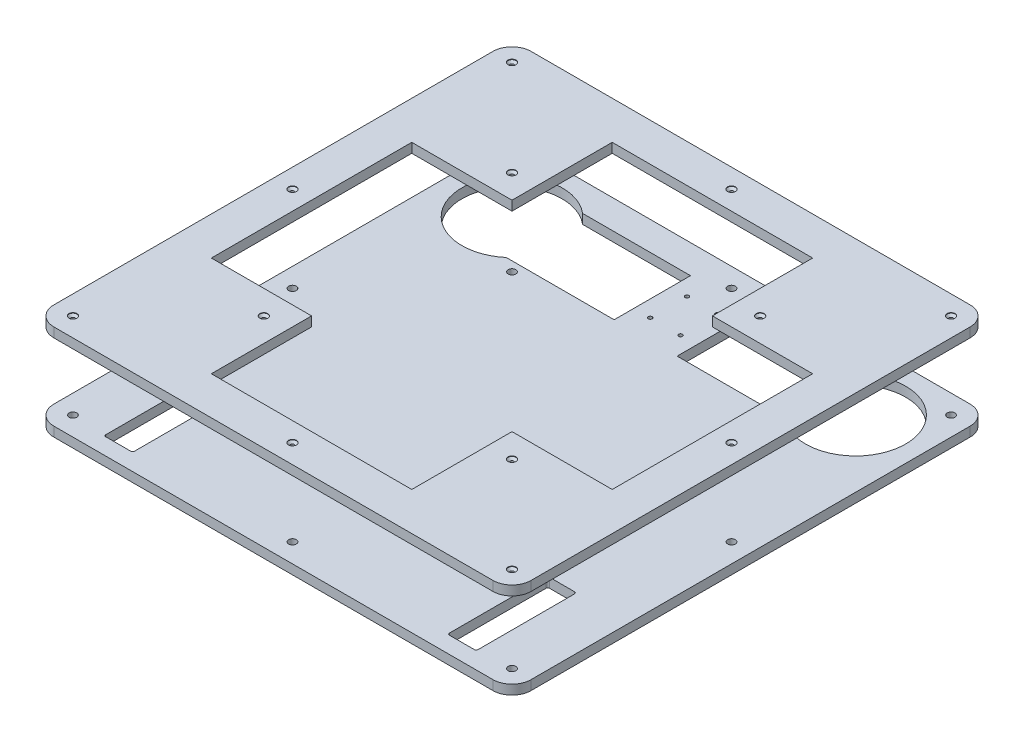
from build123d import *

# Parameters (mm, degrees)
SKETCH1_R                     = 4
SKETCH1_R_2                   = 2
BOSS_EXTRUDE1_DEPTH           = 10
SKETCH3_R                     = 2
BOSS_EXTRUDE2_DEPTH           = 10
SKETCH8_R                     = 4.2
CUT_EXTRUDE3_DEPTH            = 0.5
SKETCH10_R                    = 2
CUT_EXTRUDE4_DEPTH            = 2.2
CUT_EXTRUDE4_DRAFT            = -45
CUT_EXTRUDE4_PROFILE_2_DEPTH  = 2.2
CUT_EXTRUDE4_PROFILE_2_DRAFT  = -45
CUT_EXTRUDE4_PROFILE_3_DEPTH  = 2.2
CUT_EXTRUDE4_PROFILE_3_DRAFT  = -45
CUT_EXTRUDE4_PROFILE_4_DEPTH  = 2.2
CUT_EXTRUDE4_PROFILE_4_DRAFT  = -45
CUT_EXTRUDE4_PROFILE_5_DEPTH  = 2.2
CUT_EXTRUDE4_PROFILE_5_DRAFT  = -45
CUT_EXTRUDE4_PROFILE_6_DEPTH  = 2.2
CUT_EXTRUDE4_PROFILE_6_DRAFT  = -45
CUT_EXTRUDE4_PROFILE_7_DEPTH  = 2.2
CUT_EXTRUDE4_PROFILE_7_DRAFT  = -45
CUT_EXTRUDE4_PROFILE_8_DEPTH  = 2.2
CUT_EXTRUDE4_PROFILE_8_DRAFT  = -45
CUT_EXTRUDE4_PROFILE_9_DEPTH  = 2.2
CUT_EXTRUDE4_PROFILE_9_DRAFT  = -45
CUT_EXTRUDE4_PROFILE_10_DEPTH = 2.2
CUT_EXTRUDE4_PROFILE_10_DRAFT = -45
CUT_EXTRUDE4_PROFILE_11_DEPTH = 2.2
CUT_EXTRUDE4_PROFILE_11_DRAFT = -45
CUT_EXTRUDE4_PROFILE_12_DEPTH = 2.2
CUT_EXTRUDE4_PROFILE_12_DRAFT = -45


with BuildPart() as part:
    # Sketch1 → Boss-Extrude1 (new body)
    with BuildSketch(Plane(origin=(0, 0, 0), x_dir=(1, 0, 0), z_dir=(0, 1, 0))):
        with BuildLine():
            Line((-230, -250), (230, -250))
            ThreePointArc((230, -250), (244.142135624, -244.142135624), (250, -230))
            Line((250, -230), (250, 230))
            ThreePointArc((250, 230), (244.142135624, 244.142135624), (230, 250))
            Line((230, 250), (-230, 250))
            ThreePointArc((-230, 250), (-244.142135624, 244.142135624), (-250, 230))
            Line((-250, 230), (-250, -230))
            ThreePointArc((-250, -230), (-244.142135624, -244.142135624), (-230, -250))
        make_face()
        with Locations(Location((-230, 230, 0), (0, 0, 270))):
            Circle(SKETCH1_R, mode=Mode.SUBTRACT)
        with Locations(Location((230, 230, 0), (0, 0, 270))):
            Circle(SKETCH1_R, mode=Mode.SUBTRACT)
        with Locations(Location((230, -230, 0), (0, 0, 270))):
            Circle(SKETCH1_R, mode=Mode.SUBTRACT)
        with Locations(Location((-230, -230, 0), (0, 0, 270))):
            Circle(SKETCH1_R, mode=Mode.SUBTRACT)
        with Locations(Location((0, 230, 0), (0, 0, 270))):
            Circle(SKETCH1_R, mode=Mode.SUBTRACT)
        with Locations(Location((-230, 0, 0), (0, 0, 270))):
            Circle(SKETCH1_R, mode=Mode.SUBTRACT)
        with Locations(Location((230, 0, 0), (0, 0, 90))):
            Circle(SKETCH1_R, mode=Mode.SUBTRACT)
        with Locations(Location((0, -230, 0), (0, 0, 90))):
            Circle(SKETCH1_R, mode=Mode.SUBTRACT)
        with Locations(Location((-130, 130, 0), (0, 0, 270))):
            Circle(SKETCH1_R, mode=Mode.SUBTRACT)
        with Locations(Location((130, 130, 0), (0, 0, 90))):
            Circle(SKETCH1_R, mode=Mode.SUBTRACT)
        with Locations(Location((-130, -130, 0), (0, 0, 90))):
            Circle(SKETCH1_R, mode=Mode.SUBTRACT)
        with Locations(Location((130, -130, 0), (0, 0, 270))):
            Circle(SKETCH1_R, mode=Mode.SUBTRACT)
        with Locations(Location((15.90957387, 199.284331964, 0), (0, 0, 270))):
            Circle(SKETCH1_R_2, mode=Mode.SUBTRACT)
        with Locations(Location((15.90957387, 160.715668036, 0), (0, 0, 270))):
            Circle(SKETCH1_R_2, mode=Mode.SUBTRACT)
        with Locations(Location((-15.90957387, 160.715668036, 0), (0, 0, 270))):
            Circle(SKETCH1_R_2, mode=Mode.SUBTRACT)
        with Locations(Location((-15.90957387, 199.284331964, 0), (0, 0, 270))):
            Circle(SKETCH1_R_2, mode=Mode.SUBTRACT)
        with BuildLine():
            Line((-193, -232.5), (-167, -232.5))
            ThreePointArc((-167, -232.5), (-165.585786438, -231.914213562), (-165, -230.5))
            Line((-165, -230.5), (-165, -129.5))
            ThreePointArc((-165, -129.5), (-165.585786438, -128.085786438), (-167, -127.5))
            Line((-167, -127.5), (-193, -127.5))
            ThreePointArc((-193, -127.5), (-194.414213562, -128.085786438), (-195, -129.5))
            Line((-195, -129.5), (-195, -230.5))
            ThreePointArc((-195, -230.5), (-194.414213562, -231.914213562), (-193, -232.5))
        make_face(mode=Mode.SUBTRACT)
        with BuildLine():
            Line((193, -232.5), (167, -232.5))
            ThreePointArc((167, -232.5), (165.585786438, -231.914213562), (165, -230.5))
            Line((165, -230.5), (165, -129.5))
            ThreePointArc((165, -129.5), (165.585786438, -128.085786438), (167, -127.5))
            Line((167, -127.5), (193, -127.5))
            ThreePointArc((193, -127.5), (194.414213562, -128.085786438), (195, -129.5))
            Line((195, -129.5), (195, -230.5))
            ThreePointArc((195, -230.5), (194.414213562, -231.914213562), (193, -232.5))
        make_face(mode=Mode.SUBTRACT)
        with BuildLine():
            Line((33, 220), (145.996323728, 220))
            ThreePointArc((145.996323728, 220), (232.5, 180), (145.996323728, 140))
            Line((145.996323728, 140), (33, 140))
            Line((33, 140), (33, 220))
        make_face(mode=Mode.SUBTRACT)
        with BuildLine():
            Line((-33, 220), (-33, 140))
            Line((-33, 140), (-145.996323728, 140))
            ThreePointArc((-145.996323728, 140), (-232.5, 180), (-145.996323728, 220))
            Line((-145.996323728, 220), (-33, 220))
        make_face(mode=Mode.SUBTRACT)
    extrude(amount=-BOSS_EXTRUDE1_DEPTH)


with BuildPart() as body_2:
    # Sketch3 → Boss-Extrude2 (new body)
    with BuildSketch(Plane(origin=(0, 80, 0), x_dir=(1, 0, 0), z_dir=(0, 1, 0))):
        with BuildLine():
            ThreePointArc((-250, -230), (-244.142135624, -244.142135624), (-230, -250))
            Line((-230, -250), (230, -250))
            ThreePointArc((230, -250), (244.142135624, -244.142135624), (250, -230))
            Line((250, -230), (250, 230))
            ThreePointArc((250, 230), (244.142135624, 244.142135624), (230, 250))
            Line((230, 250), (-230, 250))
            ThreePointArc((-230, 250), (-244.142135624, 244.142135624), (-250, 230))
            Line((-250, 230), (-250, -230))
        make_face()
        with Locations(Location((-230, -230, 0), (0, 0, 270))):
            Circle(SKETCH3_R, mode=Mode.SUBTRACT)
        with Locations(Location((-130, -130, 0), (0, 0, 270))):
            Circle(SKETCH3_R, mode=Mode.SUBTRACT)
        with Locations(Location((0, -230, 0), (0, 0, 270))):
            Circle(SKETCH3_R, mode=Mode.SUBTRACT)
        with Locations(Location((-230, 0, 0), (0, 0, 270))):
            Circle(SKETCH3_R, mode=Mode.SUBTRACT)
        with Locations(Location((230, -230, 0), (0, 0, 270))):
            Circle(SKETCH3_R, mode=Mode.SUBTRACT)
        with Locations(Location((130, -130, 0), (0, 0, 270))):
            Circle(SKETCH3_R, mode=Mode.SUBTRACT)
        Polygon((105, -210), (-105, -210), (-105, -105), (-210, -105), (-210, 105), (-105, 105), (-105, 210), (105, 210), (105, 105), (210, 105), (210, -105), (105, -105), align=None, mode=Mode.SUBTRACT)
        with Locations(Location((230, 0, 0), (0, 0, 270))):
            Circle(SKETCH3_R, mode=Mode.SUBTRACT)
        with Locations(Location((-130, 130, 0), (0, 0, 270))):
            Circle(SKETCH3_R, mode=Mode.SUBTRACT)
        with Locations(Location((-230, 230, 0), (0, 0, 270))):
            Circle(SKETCH3_R, mode=Mode.SUBTRACT)
        with Locations(Location((0, 230, 0), (0, 0, 270))):
            Circle(SKETCH3_R, mode=Mode.SUBTRACT)
        with Locations(Location((130, 130, 0), (0, 0, 270))):
            Circle(SKETCH3_R, mode=Mode.SUBTRACT)
        with Locations(Location((230, 230, 0), (0, 0, 270))):
            Circle(SKETCH3_R, mode=Mode.SUBTRACT)
    extrude(amount=BOSS_EXTRUDE2_DEPTH)

    # Sketch8 → Cut-Extrude3 (cut)
    with BuildSketch(Plane(origin=(0, 90, 0), x_dir=(1, 0, 0), z_dir=(0, 1, 0))):
        with Locations(Location((-230, 230, 0), (0, 0, 270))):
            Circle(SKETCH8_R)
        with Locations(Location((0, 230, 0), (0, 0, 270))):
            Circle(SKETCH8_R)
        with Locations(Location((230, 230, 0), (0, 0, 270))):
            Circle(SKETCH8_R)
        with Locations(Location((-130, 130, 0), (0, 0, 270))):
            Circle(SKETCH8_R)
        with Locations(Location((-230, 0, 0), (0, 0, 270))):
            Circle(SKETCH8_R)
        with Locations(Location((-130, -130, 0), (0, 0, 270))):
            Circle(SKETCH8_R)
        with Locations(Location((130, 130, 0), (0, 0, 270))):
            Circle(SKETCH8_R)
        with Locations(Location((230, 0, 0), (0, 0, 270))):
            Circle(SKETCH8_R)
        with Locations(Location((130, -130, 0), (0, 0, 270))):
            Circle(SKETCH8_R)
        with Locations(Location((230, -230, 0), (0, 0, 270))):
            Circle(SKETCH8_R)
        with Locations(Location((0, -230, 0), (0, 0, 270))):
            Circle(SKETCH8_R)
        with Locations(Location((-230, -230, 0), (0, 0, 270))):
            Circle(SKETCH8_R)
    extrude(amount=-CUT_EXTRUDE3_DEPTH, mode=Mode.SUBTRACT)


with BuildPart() as cut_extrude4_tool:
    # Sketch10 → Cut-Extrude4 (with draft: the straight prism first)
    with BuildSketch(Plane(origin=(0, 87.3, 0), x_dir=(1, 0, 0), z_dir=(0, 1, 0))):
        with Locations(Location((-230, -230, 0), (0, 0, 270))):
            Circle(SKETCH10_R)
    extrude(amount=CUT_EXTRUDE4_DEPTH)
    # Cut-Extrude4: the draft: its side faces are tilted about the plane it starts from
    cut_extrude4_sides = [cut_extrude4_tool.faces().sort_by_distance(p)[0] for p in [
        (-230, 88.4, 228),
    ]]
    draft(cut_extrude4_sides, Plane(origin=(0, 87.3, 0), x_dir=(1, 0, 0), z_dir=(0, 1, 0)), CUT_EXTRUDE4_DRAFT)


with BuildPart() as body_2_1:
    add(body_2.part)

    # Cut-Extrude4: cut by cut_extrude4_tool
    add(cut_extrude4_tool.part, mode=Mode.SUBTRACT)


with BuildPart() as cut_extrude4_profile_2_tool:
    # Sketch10 → Cut-Extrude4 profile 2 (with draft: the straight prism first)
    with BuildSketch(Plane(origin=(0, 87.3, 0), x_dir=(1, 0, 0), z_dir=(0, 1, 0))):
        with Locations(Location((-130, -130, 0), (0, 0, 270))):
            Circle(SKETCH10_R)
    extrude(amount=CUT_EXTRUDE4_PROFILE_2_DEPTH)
    # Cut-Extrude4 profile 2: the draft: its side faces are tilted about the plane it starts from
    cut_extrude4_profile_2_sides = [cut_extrude4_profile_2_tool.faces().sort_by_distance(p)[0] for p in [
        (-130, 88.4, 128),
    ]]
    draft(cut_extrude4_profile_2_sides, Plane(origin=(0, 87.3, 0), x_dir=(1, 0, 0), z_dir=(0, 1, 0)), CUT_EXTRUDE4_PROFILE_2_DRAFT)


with BuildPart() as body_2_2:
    add(body_2_1.part)

    # Cut-Extrude4 profile 2: cut by cut_extrude4_profile_2_tool
    add(cut_extrude4_profile_2_tool.part, mode=Mode.SUBTRACT)


with BuildPart() as cut_extrude4_profile_3_tool:
    # Sketch10 → Cut-Extrude4 profile 3 (with draft: the straight prism first)
    with BuildSketch(Plane(origin=(0, 87.3, 0), x_dir=(1, 0, 0), z_dir=(0, 1, 0))):
        with Locations(Location((0, -230, 0), (0, 0, 270))):
            Circle(SKETCH10_R)
    extrude(amount=CUT_EXTRUDE4_PROFILE_3_DEPTH)
    # Cut-Extrude4 profile 3: the draft: its side faces are tilted about the plane it starts from
    cut_extrude4_profile_3_sides = [cut_extrude4_profile_3_tool.faces().sort_by_distance(p)[0] for p in [
        (0, 88.4, 228),
    ]]
    draft(cut_extrude4_profile_3_sides, Plane(origin=(0, 87.3, 0), x_dir=(1, 0, 0), z_dir=(0, 1, 0)), CUT_EXTRUDE4_PROFILE_3_DRAFT)


with BuildPart() as body_2_3:
    add(body_2_2.part)

    # Cut-Extrude4 profile 3: cut by cut_extrude4_profile_3_tool
    add(cut_extrude4_profile_3_tool.part, mode=Mode.SUBTRACT)


with BuildPart() as cut_extrude4_profile_4_tool:
    # Sketch10 → Cut-Extrude4 profile 4 (with draft: the straight prism first)
    with BuildSketch(Plane(origin=(0, 87.3, 0), x_dir=(1, 0, 0), z_dir=(0, 1, 0))):
        with Locations(Location((230, -230, 0), (0, 0, 270))):
            Circle(SKETCH10_R)
    extrude(amount=CUT_EXTRUDE4_PROFILE_4_DEPTH)
    # Cut-Extrude4 profile 4: the draft: its side faces are tilted about the plane it starts from
    cut_extrude4_profile_4_sides = [cut_extrude4_profile_4_tool.faces().sort_by_distance(p)[0] for p in [
        (230, 88.4, 228),
    ]]
    draft(cut_extrude4_profile_4_sides, Plane(origin=(0, 87.3, 0), x_dir=(1, 0, 0), z_dir=(0, 1, 0)), CUT_EXTRUDE4_PROFILE_4_DRAFT)


with BuildPart() as body_2_4:
    add(body_2_3.part)

    # Cut-Extrude4 profile 4: cut by cut_extrude4_profile_4_tool
    add(cut_extrude4_profile_4_tool.part, mode=Mode.SUBTRACT)


with BuildPart() as cut_extrude4_profile_5_tool:
    # Sketch10 → Cut-Extrude4 profile 5 (with draft: the straight prism first)
    with BuildSketch(Plane(origin=(0, 87.3, 0), x_dir=(1, 0, 0), z_dir=(0, 1, 0))):
        with Locations(Location((130, -130, 0), (0, 0, 270))):
            Circle(SKETCH10_R)
    extrude(amount=CUT_EXTRUDE4_PROFILE_5_DEPTH)
    # Cut-Extrude4 profile 5: the draft: its side faces are tilted about the plane it starts from
    cut_extrude4_profile_5_sides = [cut_extrude4_profile_5_tool.faces().sort_by_distance(p)[0] for p in [
        (130, 88.4, 128),
    ]]
    draft(cut_extrude4_profile_5_sides, Plane(origin=(0, 87.3, 0), x_dir=(1, 0, 0), z_dir=(0, 1, 0)), CUT_EXTRUDE4_PROFILE_5_DRAFT)


with BuildPart() as body_2_5:
    add(body_2_4.part)

    # Cut-Extrude4 profile 5: cut by cut_extrude4_profile_5_tool
    add(cut_extrude4_profile_5_tool.part, mode=Mode.SUBTRACT)


with BuildPart() as cut_extrude4_profile_6_tool:
    # Sketch10 → Cut-Extrude4 profile 6 (with draft: the straight prism first)
    with BuildSketch(Plane(origin=(0, 87.3, 0), x_dir=(1, 0, 0), z_dir=(0, 1, 0))):
        with Locations(Location((230, 0, 0), (0, 0, 270))):
            Circle(SKETCH10_R)
    extrude(amount=CUT_EXTRUDE4_PROFILE_6_DEPTH)
    # Cut-Extrude4 profile 6: the draft: its side faces are tilted about the plane it starts from
    cut_extrude4_profile_6_sides = [cut_extrude4_profile_6_tool.faces().sort_by_distance(p)[0] for p in [
        (230, 88.4, -2),
    ]]
    draft(cut_extrude4_profile_6_sides, Plane(origin=(0, 87.3, 0), x_dir=(1, 0, 0), z_dir=(0, 1, 0)), CUT_EXTRUDE4_PROFILE_6_DRAFT)


with BuildPart() as body_2_6:
    add(body_2_5.part)

    # Cut-Extrude4 profile 6: cut by cut_extrude4_profile_6_tool
    add(cut_extrude4_profile_6_tool.part, mode=Mode.SUBTRACT)


with BuildPart() as cut_extrude4_profile_7_tool:
    # Sketch10 → Cut-Extrude4 profile 7 (with draft: the straight prism first)
    with BuildSketch(Plane(origin=(0, 87.3, 0), x_dir=(1, 0, 0), z_dir=(0, 1, 0))):
        with Locations(Location((130, 130, 0), (0, 0, 270))):
            Circle(SKETCH10_R)
    extrude(amount=CUT_EXTRUDE4_PROFILE_7_DEPTH)
    # Cut-Extrude4 profile 7: the draft: its side faces are tilted about the plane it starts from
    cut_extrude4_profile_7_sides = [cut_extrude4_profile_7_tool.faces().sort_by_distance(p)[0] for p in [
        (130, 88.4, -132),
    ]]
    draft(cut_extrude4_profile_7_sides, Plane(origin=(0, 87.3, 0), x_dir=(1, 0, 0), z_dir=(0, 1, 0)), CUT_EXTRUDE4_PROFILE_7_DRAFT)


with BuildPart() as body_2_7:
    add(body_2_6.part)

    # Cut-Extrude4 profile 7: cut by cut_extrude4_profile_7_tool
    add(cut_extrude4_profile_7_tool.part, mode=Mode.SUBTRACT)


with BuildPart() as cut_extrude4_profile_8_tool:
    # Sketch10 → Cut-Extrude4 profile 8 (with draft: the straight prism first)
    with BuildSketch(Plane(origin=(0, 87.3, 0), x_dir=(1, 0, 0), z_dir=(0, 1, 0))):
        with Locations(Location((230, 230, 0), (0, 0, 270))):
            Circle(SKETCH10_R)
    extrude(amount=CUT_EXTRUDE4_PROFILE_8_DEPTH)
    # Cut-Extrude4 profile 8: the draft: its side faces are tilted about the plane it starts from
    cut_extrude4_profile_8_sides = [cut_extrude4_profile_8_tool.faces().sort_by_distance(p)[0] for p in [
        (230, 88.4, -232),
    ]]
    draft(cut_extrude4_profile_8_sides, Plane(origin=(0, 87.3, 0), x_dir=(1, 0, 0), z_dir=(0, 1, 0)), CUT_EXTRUDE4_PROFILE_8_DRAFT)


with BuildPart() as body_2_8:
    add(body_2_7.part)

    # Cut-Extrude4 profile 8: cut by cut_extrude4_profile_8_tool
    add(cut_extrude4_profile_8_tool.part, mode=Mode.SUBTRACT)


with BuildPart() as cut_extrude4_profile_9_tool:
    # Sketch10 → Cut-Extrude4 profile 9 (with draft: the straight prism first)
    with BuildSketch(Plane(origin=(0, 87.3, 0), x_dir=(1, 0, 0), z_dir=(0, 1, 0))):
        with Locations(Location((0, 230, 0), (0, 0, 270))):
            Circle(SKETCH10_R)
    extrude(amount=CUT_EXTRUDE4_PROFILE_9_DEPTH)
    # Cut-Extrude4 profile 9: the draft: its side faces are tilted about the plane it starts from
    cut_extrude4_profile_9_sides = [cut_extrude4_profile_9_tool.faces().sort_by_distance(p)[0] for p in [
        (0, 88.4, -232),
    ]]
    draft(cut_extrude4_profile_9_sides, Plane(origin=(0, 87.3, 0), x_dir=(1, 0, 0), z_dir=(0, 1, 0)), CUT_EXTRUDE4_PROFILE_9_DRAFT)


with BuildPart() as body_2_9:
    add(body_2_8.part)

    # Cut-Extrude4 profile 9: cut by cut_extrude4_profile_9_tool
    add(cut_extrude4_profile_9_tool.part, mode=Mode.SUBTRACT)


with BuildPart() as cut_extrude4_profile_10_tool:
    # Sketch10 → Cut-Extrude4 profile 10 (with draft: the straight prism first)
    with BuildSketch(Plane(origin=(0, 87.3, 0), x_dir=(1, 0, 0), z_dir=(0, 1, 0))):
        with Locations(Location((-130, 130, 0), (0, 0, 270))):
            Circle(SKETCH10_R)
    extrude(amount=CUT_EXTRUDE4_PROFILE_10_DEPTH)
    # Cut-Extrude4 profile 10: the draft: its side faces are tilted about the plane it starts from
    cut_extrude4_profile_10_sides = [cut_extrude4_profile_10_tool.faces().sort_by_distance(p)[0] for p in [
        (-130, 88.4, -132),
    ]]
    draft(cut_extrude4_profile_10_sides, Plane(origin=(0, 87.3, 0), x_dir=(1, 0, 0), z_dir=(0, 1, 0)), CUT_EXTRUDE4_PROFILE_10_DRAFT)


with BuildPart() as body_2_10:
    add(body_2_9.part)

    # Cut-Extrude4 profile 10: cut by cut_extrude4_profile_10_tool
    add(cut_extrude4_profile_10_tool.part, mode=Mode.SUBTRACT)


with BuildPart() as cut_extrude4_profile_11_tool:
    # Sketch10 → Cut-Extrude4 profile 11 (with draft: the straight prism first)
    with BuildSketch(Plane(origin=(0, 87.3, 0), x_dir=(1, 0, 0), z_dir=(0, 1, 0))):
        with Locations(Location((-230, 0, 0), (0, 0, 270))):
            Circle(SKETCH10_R)
    extrude(amount=CUT_EXTRUDE4_PROFILE_11_DEPTH)
    # Cut-Extrude4 profile 11: the draft: its side faces are tilted about the plane it starts from
    cut_extrude4_profile_11_sides = [cut_extrude4_profile_11_tool.faces().sort_by_distance(p)[0] for p in [
        (-230, 88.4, -2),
    ]]
    draft(cut_extrude4_profile_11_sides, Plane(origin=(0, 87.3, 0), x_dir=(1, 0, 0), z_dir=(0, 1, 0)), CUT_EXTRUDE4_PROFILE_11_DRAFT)


with BuildPart() as body_2_11:
    add(body_2_10.part)

    # Cut-Extrude4 profile 11: cut by cut_extrude4_profile_11_tool
    add(cut_extrude4_profile_11_tool.part, mode=Mode.SUBTRACT)


with BuildPart() as cut_extrude4_profile_12_tool:
    # Sketch10 → Cut-Extrude4 profile 12 (with draft: the straight prism first)
    with BuildSketch(Plane(origin=(0, 87.3, 0), x_dir=(1, 0, 0), z_dir=(0, 1, 0))):
        with Locations(Location((-230, 230, 0), (0, 0, 270))):
            Circle(SKETCH10_R)
    extrude(amount=CUT_EXTRUDE4_PROFILE_12_DEPTH)
    # Cut-Extrude4 profile 12: the draft: its side faces are tilted about the plane it starts from
    cut_extrude4_profile_12_sides = [cut_extrude4_profile_12_tool.faces().sort_by_distance(p)[0] for p in [
        (-230, 88.4, -232),
    ]]
    draft(cut_extrude4_profile_12_sides, Plane(origin=(0, 87.3, 0), x_dir=(1, 0, 0), z_dir=(0, 1, 0)), CUT_EXTRUDE4_PROFILE_12_DRAFT)


with BuildPart() as body_2_12:
    add(body_2_11.part)

    # Cut-Extrude4 profile 12: cut by cut_extrude4_profile_12_tool
    add(cut_extrude4_profile_12_tool.part, mode=Mode.SUBTRACT)


solid = Compound([part.part, body_2_12.part])
